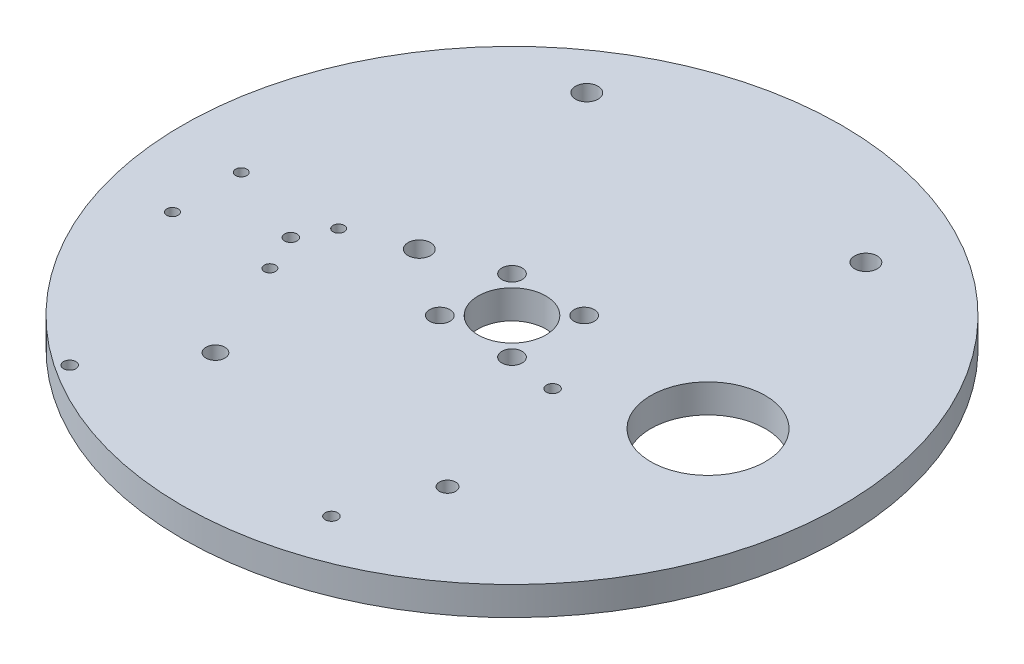
from build123d import *

# Parameters (mm, degrees)
SKETCH1_R           = 73.025
BOSS_EXTRUDE1_DEPTH = 6.35
SKETCH2_R           = 7.5
CUT_EXTRUDE1_DEPTH  = 104.467984179
SKETCH3_R           = 2.25
CUT_EXTRUDE2_DEPTH  = 104.467984179
SKETCH4_R           = 12.7
CUT_EXTRUDE3_DEPTH  = 104.467984179
SKETCH5_R           = 1.25
CUT_EXTRUDE4_DEPTH  = 104.467984179
SKETCH6_R           = 2.5
SKETCH6_R_2         = 2.2225
CUT_EXTRUDE5_DEPTH  = 104.467984179


with BuildPart() as part:
    # Sketch1 → Boss-Extrude1 (new body)
    with BuildSketch(Plane(origin=(0, 0, 0), x_dir=(1, 0, 0), z_dir=(0, 1, 0))):
        with Locations(Location((0, 0, 0), (0, 0, 270))):
            Circle(SKETCH1_R)
    extrude(amount=BOSS_EXTRUDE1_DEPTH)

    # Sketch2 → Cut-Extrude1 (cut, through all)
    with BuildSketch(Plane(origin=(0, 6.35, 0), x_dir=(1, 0, 0), z_dir=(0, 1, 0))):
        with Locations(Location((0, 0, 0), (0, 0, 270))):
            Circle(SKETCH2_R)
    extrude(amount=-CUT_EXTRUDE1_DEPTH, mode=Mode.SUBTRACT)

    # Sketch3 → Cut-Extrude2 (cut, through all)
    with BuildSketch(Plane(origin=(0, 6.35, 0), x_dir=(1, 0, 0), z_dir=(0, 1, 0))):
        with Locations(Location((-8, 8, 0), (0, 0, 270))):
            Circle(SKETCH3_R)
        with Locations(Location((8, 8, 0), (0, 0, 270))):
            Circle(SKETCH3_R)
        with Locations(Location((8, -8, 0), (0, 0, 270))):
            Circle(SKETCH3_R)
        with Locations(Location((-8, -8, 0), (0, 0, 270))):
            Circle(SKETCH3_R)
    extrude(amount=-CUT_EXTRUDE2_DEPTH, mode=Mode.SUBTRACT)

    # Sketch4 → Cut-Extrude3 (cut, through all)
    with BuildSketch(Plane.XZ):
        with Locations(Location((43.43418184, 0, 0), (0, 0, 270))):
            Circle(SKETCH4_R)
    extrude(amount=-CUT_EXTRUDE3_DEPTH, mode=Mode.SUBTRACT)

    # Sketch5 → Cut-Extrude4 (cut, through all)
    with BuildSketch(Plane.XZ):
        with BuildLine():
            ThreePointArc((-25.717186912, 42.1), (-27.817186912, 40), (-25.717186912, 37.9))
            ThreePointArc((-25.717186912, 37.9), (-24.232262671, 38.51507576), (-23.617186912, 40))
            ThreePointArc((-23.617186912, 40), (-24.232262671, 41.48492424), (-25.717186912, 42.1))
        make_face()
        with Locations(Location((-57.46, 17.78, 0), (0, 0, 270))):
            Circle(SKETCH5_R)
        with BuildLine():
            ThreePointArc((-38.095362557, 9.539806393), (-39.470362557, 10.914806393), (-40.845362557, 9.539806393))
            ThreePointArc((-40.845362557, 9.539806393), (-39.470362557, 8.164806393), (-38.095362557, 9.539806393))
        make_face()
        with Locations(Location((-35.87, 2.54, 0), (0, 0, 270))):
            Circle(SKETCH5_R)
        with Locations(Location((-57.46, 2.54, 0), (0, 0, 270))):
            Circle(SKETCH5_R)
        with BuildLine():
            ThreePointArc((-38.095362557, 58.539806393), (-39.470362557, 59.914806393), (-40.845362557, 58.539806393))
            ThreePointArc((-40.845362557, 58.539806393), (-39.470362557, 57.164806393), (-38.095362557, 58.539806393))
        make_face()
        with BuildLine():
            ThreePointArc((17.154637443, 58.539806393), (18.529637443, 57.164806393), (19.904637443, 58.539806393))
            ThreePointArc((19.904637443, 58.539806393), (18.529637443, 59.914806393), (17.154637443, 58.539806393))
        make_face()
        with BuildLine():
            ThreePointArc((25.717186912, 41.8), (23.917186912, 40), (25.717186912, 38.2))
            ThreePointArc((25.717186912, 38.2), (26.989979118, 38.727207794), (27.517186912, 40))
            ThreePointArc((27.517186912, 40), (26.989979118, 41.272792206), (25.717186912, 41.8))
        make_face()
        with BuildLine():
            ThreePointArc((19.904637443, 9.539806393), (18.529637443, 10.914806393), (17.154637443, 9.539806393))
            ThreePointArc((17.154637443, 9.539806393), (18.529637443, 8.164806393), (19.904637443, 9.539806393))
        make_face()
        with Locations(Location((-35.87, 17.78, 0), (0, 0, 270))):
            Circle(SKETCH5_R)
    extrude(amount=-CUT_EXTRUDE4_DEPTH, mode=Mode.SUBTRACT)

    # Sketch6 → Cut-Extrude5 (cut, through all)
    # profile 1 of 6: a face of its own
    with BuildSketch(Plane(origin=(0, 6.35, 0), x_dir=(1, 0, 0), z_dir=(0, 1, 0))):
        with Locations(Location((-34.460546587, 51.030675215, 0), (0, 0, 270))):
            Circle(SKETCH6_R)
        with Locations((-34.460546587, 51.030675215)):
            Circle(SKETCH6_R_2, mode=Mode.SUBTRACT)
    # profile 2 of 6: a face of its own
    with BuildSketch(Plane(origin=(0, 6.35, 0), x_dir=(1, 0, 0), z_dir=(0, 1, 0))):
        with Locations((-34.460546587, 51.030675215)):
            Circle(SKETCH6_R_2)
    # profile 3 of 6: a face of its own
    with BuildSketch(Plane(origin=(0, 6.35, 0), x_dir=(1, 0, 0), z_dir=(0, 1, 0))):
        with Locations(Location((29.018504419, 49.399698988, 0), (0, 0, 270))):
            Circle(SKETCH6_R)
        with Locations((29.018504419, 49.399698988)):
            Circle(SKETCH6_R_2, mode=Mode.SUBTRACT)
    # profile 4 of 6: a face of its own
    with BuildSketch(Plane(origin=(0, 6.35, 0), x_dir=(1, 0, 0), z_dir=(0, 1, 0))):
        with Locations((29.018504419, 49.399698988)):
            Circle(SKETCH6_R_2)
    # profile 5 of 6: a face of its own
    with BuildSketch(Plane(origin=(0, 6.35, 0), x_dir=(1, 0, 0), z_dir=(0, 1, 0))):
        with Locations(Location((-23.004278318, 2.460401205, 0), (0, 0, 270))):
            Circle(SKETCH6_R)
        with Locations((-23.004278318, 2.460401205)):
            Circle(SKETCH6_R_2, mode=Mode.SUBTRACT)
    # profile 6 of 6: a face of its own
    with BuildSketch(Plane(origin=(0, 6.35, 0), x_dir=(1, 0, 0), z_dir=(0, 1, 0))):
        with Locations((-23.004278318, 2.460401205)):
            Circle(SKETCH6_R_2)
    extrude(amount=-CUT_EXTRUDE5_DEPTH, mode=Mode.SUBTRACT)


solid = part.part
